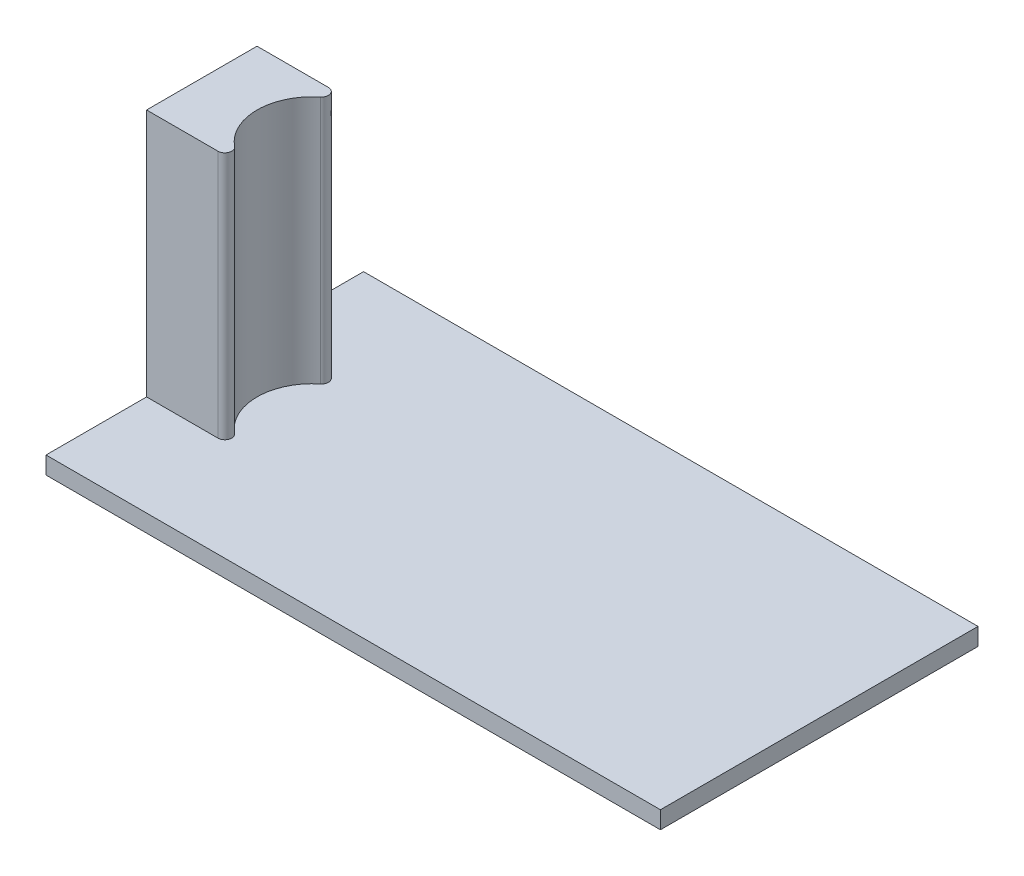
from build123d import *

# Parameters (mm, degrees)
BOSS_EXTRUDE1_DEPTH = 57.15
SKETCH4_W           = 21.391570407
SKETCH4_H           = 73.03
BOSS_EXTRUDE2_DEPTH = 4
SKETCH5_W           = 119.908429593
SKETCH5_H           = 73.03
BOSS_EXTRUDE3_DEPTH = 4


with BuildPart() as part:
    # Sketch3 → Boss-Extrude1 (new body)
    with BuildSketch(Plane(origin=(0, 0, 0), x_dir=(1, 0, 0), z_dir=(0, 1, 0))):
        with BuildLine():
            Line((-27.78125, 0), (-27.78125, 25.4))
            Line((-27.78125, 25.4), (-11.361506121, 25.4))
            ThreePointArc((-11.361506121, 25.4), (-9.864796768, 24.341666667), (-10.363699885, 22.577777778))
            ThreePointArc((-10.363699885, 22.577777778), (-15.08125, 12.7), (-10.363699885, 2.822222222))
            ThreePointArc((-10.363699885, 2.822222222), (-9.864796768, 1.058333333), (-11.361506121, 0))
            Line((-11.361506121, 0), (-27.78125, 0))
        make_face()
    extrude(amount=BOSS_EXTRUDE1_DEPTH)

    # Sketch4 → Boss-Extrude2 (add)
    with BuildSketch(Plane.XZ):
        with Locations((-17.085464796, -13.384999898)):
            Rectangle(SKETCH4_W, SKETCH4_H)
    extrude(amount=BOSS_EXTRUDE2_DEPTH)

    # Sketch5 → Boss-Extrude3 (add)
    with BuildSketch(Plane(origin=(0, -4, 0), x_dir=(-1, 0, 0), z_dir=(0, -1, 0))):
        with Locations((-53.564535204, 13.384999898)):
            Rectangle(SKETCH5_W, SKETCH5_H)
    extrude(amount=-BOSS_EXTRUDE3_DEPTH)


solid = part.part
